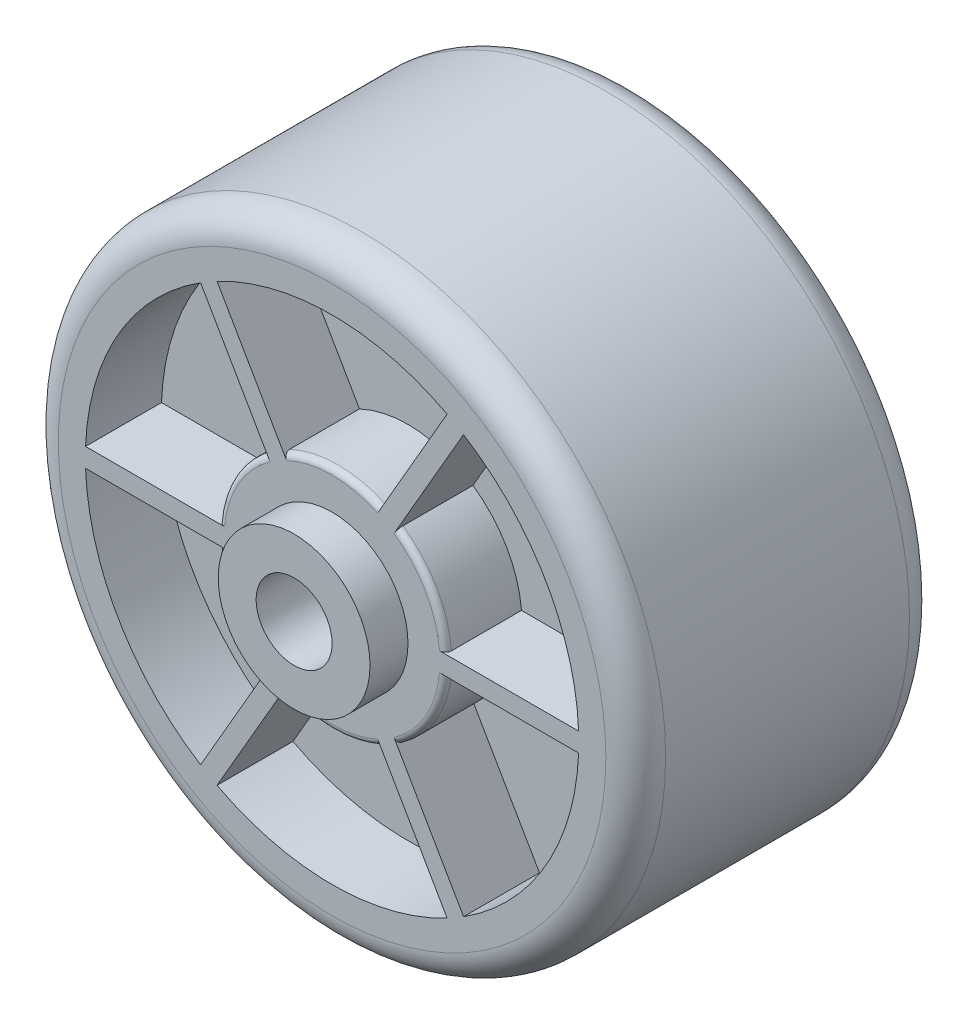
from build123d import *

# Parameters (mm, degrees)
BOSS_EXTRUDE1_DEPTH      = 25.4
BOSS_EXTRUDE1_DEPTH_BACK = 25.4
SKETCH1_R                = 50.8
CUT_EXTRUDE1_DEPTH       = 12.7
CUT_EXTRUDE2_START       = -12.7
CUT_EXTRUDE2_DEPTH       = 12.7
SKETCH5_R                = 12.7
BOSS_EXTRUDE2_DEPTH      = 6.35
BOSS_EXTRUDE3_START      = 6.35
SKETCH6_R                = 12.7
BOSS_EXTRUDE3_DEPTH      = 6.35
SKETCH7_R                = 6.35
CUT_EXTRUDE3_DEPTH       = 96.882897328
FILLET1_R                = 5
FILLET2_R                = 1


with BuildPart() as part:
    # Sketch1 → Boss-Extrude1 (new, two sides: drawn at the far end of the back side and taken through both)
    with BuildSketch(Plane.XY.offset(-BOSS_EXTRUDE1_DEPTH_BACK)):
        Circle(SKETCH1_R)
    extrude(amount=BOSS_EXTRUDE1_DEPTH + BOSS_EXTRUDE1_DEPTH_BACK)

    # Sketch3 → Cut-Extrude1 (cut)
    with BuildSketch(Plane.XY.offset(25.4)):
        with BuildLine():
            Line((-19.247414599, -36.5125), (-8.117054136, -17.234150172))
            ThreePointArc((-8.117054136, -17.234150172), (0, -19.05), (8.117054136, -17.234150172))
            Line((8.117054136, -17.234150172), (19.247414599, -36.5125))
            ThreePointArc((19.247414599, -36.5125), (0, -41.275), (-19.247414599, -36.5125))
        make_face()
        with BuildLine():
            Line((-21.997045256, -34.925), (-10.866684793, -15.646650172))
            ThreePointArc((-10.866684793, -15.646650172), (-16.497783942, -9.525), (-18.98373893, -1.5875))
            Line((-18.98373893, -1.5875), (-41.244459855, -1.5875))
            ThreePointArc((-41.244459855, -1.5875), (-35.745198541, -20.6375), (-21.997045256, -34.925))
        make_face()
        with BuildLine():
            Line((21.997045256, -34.925), (10.866684793, -15.646650172))
            ThreePointArc((10.866684793, -15.646650172), (16.497783942, -9.525), (18.98373893, -1.5875))
            Line((18.98373893, -1.5875), (41.244459855, -1.5875))
            ThreePointArc((41.244459855, -1.5875), (35.745198541, -20.6375), (21.997045256, -34.925))
        make_face()
        with BuildLine():
            Line((-21.997045256, 34.925), (-10.866684793, 15.646650172))
            ThreePointArc((-10.866684793, 15.646650172), (-16.497783942, 9.525), (-18.98373893, 1.5875))
            Line((-18.98373893, 1.5875), (-41.244459855, 1.5875))
            ThreePointArc((-41.244459855, 1.5875), (-35.745198541, 20.6375), (-21.997045256, 34.925))
        make_face()
        with BuildLine():
            Line((41.244459855, 1.5875), (18.98373893, 1.5875))
            ThreePointArc((18.98373893, 1.5875), (16.497783942, 9.525), (10.866684793, 15.646650172))
            Line((10.866684793, 15.646650172), (21.997045256, 34.925))
            ThreePointArc((21.997045256, 34.925), (35.745198541, 20.6375), (41.244459855, 1.5875))
        make_face()
        with BuildLine():
            Line((-8.117054136, 17.234150172), (-19.247414599, 36.5125))
            ThreePointArc((-19.247414599, 36.5125), (0, 41.275), (19.247414599, 36.5125))
            Line((19.247414599, 36.5125), (8.117054136, 17.234150172))
            ThreePointArc((8.117054136, 17.234150172), (0, 19.05), (-8.117054136, 17.234150172))
        make_face()
    extrude(amount=-CUT_EXTRUDE1_DEPTH, mode=Mode.SUBTRACT)

    # Sketch4 → Cut-Extrude2 (cut)
    with BuildSketch(Plane(origin=(0, 0, -25.4), x_dir=(-1, 0, 0), z_dir=(0, 0, -1)).offset(CUT_EXTRUDE2_START)):
        with BuildLine():
            Line((21.997045256, -34.925), (10.866684793, -15.646650172))
            ThreePointArc((10.866684793, -15.646650172), (16.497783942, -9.525), (18.98373893, -1.5875))
            Line((18.98373893, -1.5875), (41.244459855, -1.5875))
            ThreePointArc((41.244459855, -1.5875), (35.745198541, -20.6375), (21.997045256, -34.925))
        make_face()
        with BuildLine():
            Line((8.117054136, -17.234150172), (19.247414599, -36.5125))
            ThreePointArc((19.247414599, -36.5125), (0, -41.275), (-19.247414599, -36.5125))
            Line((-19.247414599, -36.5125), (-8.117054136, -17.234150172))
            ThreePointArc((-8.117054136, -17.234150172), (0, -19.05), (8.117054136, -17.234150172))
        make_face()
        with BuildLine():
            Line((-10.866684793, -15.646650172), (-21.997045256, -34.925))
            ThreePointArc((-21.997045256, -34.925), (-35.745198541, -20.6375), (-41.244459855, -1.5875))
            Line((-41.244459855, -1.5875), (-18.98373893, -1.5875))
            ThreePointArc((-18.98373893, -1.5875), (-16.497783942, -9.525), (-10.866684793, -15.646650172))
        make_face()
        with BuildLine():
            Line((-21.997045256, 34.925), (-10.866684793, 15.646650172))
            ThreePointArc((-10.866684793, 15.646650172), (-16.497783942, 9.525), (-18.98373893, 1.5875))
            Line((-18.98373893, 1.5875), (-41.244459855, 1.5875))
            ThreePointArc((-41.244459855, 1.5875), (-35.745198541, 20.6375), (-21.997045256, 34.925))
        make_face()
        with BuildLine():
            Line((41.244459855, 1.5875), (18.98373893, 1.5875))
            ThreePointArc((18.98373893, 1.5875), (16.497783942, 9.525), (10.866684793, 15.646650172))
            Line((10.866684793, 15.646650172), (21.997045256, 34.925))
            ThreePointArc((21.997045256, 34.925), (35.745198541, 20.6375), (41.244459855, 1.5875))
        make_face()
        with BuildLine():
            Line((-8.117054136, 17.234150172), (-19.247414599, 36.5125))
            ThreePointArc((-19.247414599, 36.5125), (0, 41.275), (19.247414599, 36.5125))
            Line((19.247414599, 36.5125), (8.117054136, 17.234150172))
            ThreePointArc((8.117054136, 17.234150172), (0, 19.05), (-8.117054136, 17.234150172))
        make_face()
    extrude(amount=CUT_EXTRUDE2_DEPTH, mode=Mode.SUBTRACT)

    # Sketch5 → Boss-Extrude2 (add)
    with BuildSketch(Plane(origin=(0, 0, -25.4), x_dir=(-1, 0, 0), z_dir=(0, 0, -1))):
        Circle(SKETCH5_R)
    extrude(amount=BOSS_EXTRUDE2_DEPTH)

    # Sketch6 → Boss-Extrude3 (add)
    with BuildSketch(Plane.XY.offset(25.4).offset(BOSS_EXTRUDE3_START)):
        Circle(SKETCH6_R)
    extrude(amount=-BOSS_EXTRUDE3_DEPTH)

    # Sketch7 → Cut-Extrude3 (cut, through all)
    with BuildSketch(Plane.XY.offset(31.75)):
        Circle(SKETCH7_R)
    extrude(amount=-CUT_EXTRUDE3_DEPTH, mode=Mode.SUBTRACT)

    # Fillet1
    fillet1_edges = [part.edges().sort_by_distance(p)[0] for p in [
        (-50.8, 0, 25.4),
        (-50.8, 0, -25.4),
    ]]
    fillet(fillet1_edges, radius=FILLET1_R)

    # Fillet2
    fillet2_edges = [part.edges().sort_by_distance(p)[0] for p in [
        (16.497783942, 9.525, 25.4),
        (16.497783942, -9.525, 25.4),
        (0, -19.05, 25.4),
        (-16.497783942, -9.525, 25.4),
        (0, 19.05, 25.4),
        (-16.497783942, 9.525, 25.4),
        (-16.497783942, 9.525, -25.4),
        (-16.497783942, -9.525, -25.4),
        (0, -19.05, -25.4),
        (16.497783942, -9.525, -25.4),
        (16.497783942, 9.525, -25.4),
        (0, 19.05, -25.4),
    ]]
    fillet(fillet2_edges, radius=FILLET2_R)


solid = part.part
